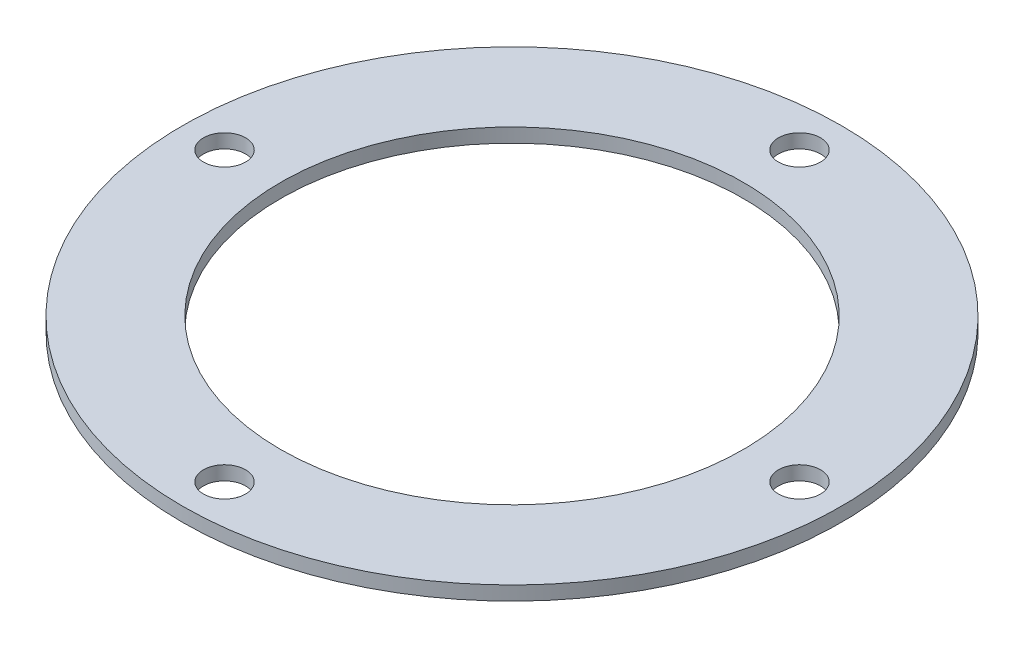
from build123d import *

# Parameters (mm, degrees)
SKETCH_1_R          = 23.5
SKETCH_1_R_2        = 16.5
EXTRUDE_1_DEPTH     = 1
SKETCH_2_R          = 1.5
CUT_EXTRUDE_1_DEPTH = 1


with BuildPart() as part:
    # 草图1 → 凸台-拉伸1 (new body)
    with BuildSketch(Plane(origin=(0, 0, 0), x_dir=(1, 0, 0), z_dir=(0, 1, 0))):
        with Locations(Location((0, 0, 0), (0, 0, 270))):
            Circle(SKETCH_1_R)
        with Locations(Location((0, 0, 0), (0, 0, 270))):
            Circle(SKETCH_1_R_2, mode=Mode.SUBTRACT)
    extrude(amount=EXTRUDE_1_DEPTH)

    # 草图2 → 切除-拉伸1 (cut)
    with BuildSketch(Plane(origin=(0, 1, 0), x_dir=(1, 0, 0), z_dir=(0, 1, 0))):
        with Locations(Location((20.5, 0, 0), (0, 0, 270))):
            Circle(SKETCH_2_R)
        with Locations(Location((0, -20.5, 0), (0, 0, 270))):
            Circle(SKETCH_2_R)
        with Locations(Location((-20.5, 0, 0), (0, 0, 270))):
            Circle(SKETCH_2_R)
        with Locations(Location((0, 20.5, 0), (0, 0, 270))):
            Circle(SKETCH_2_R)
    extrude(amount=-CUT_EXTRUDE_1_DEPTH, mode=Mode.SUBTRACT)


solid = part.part
